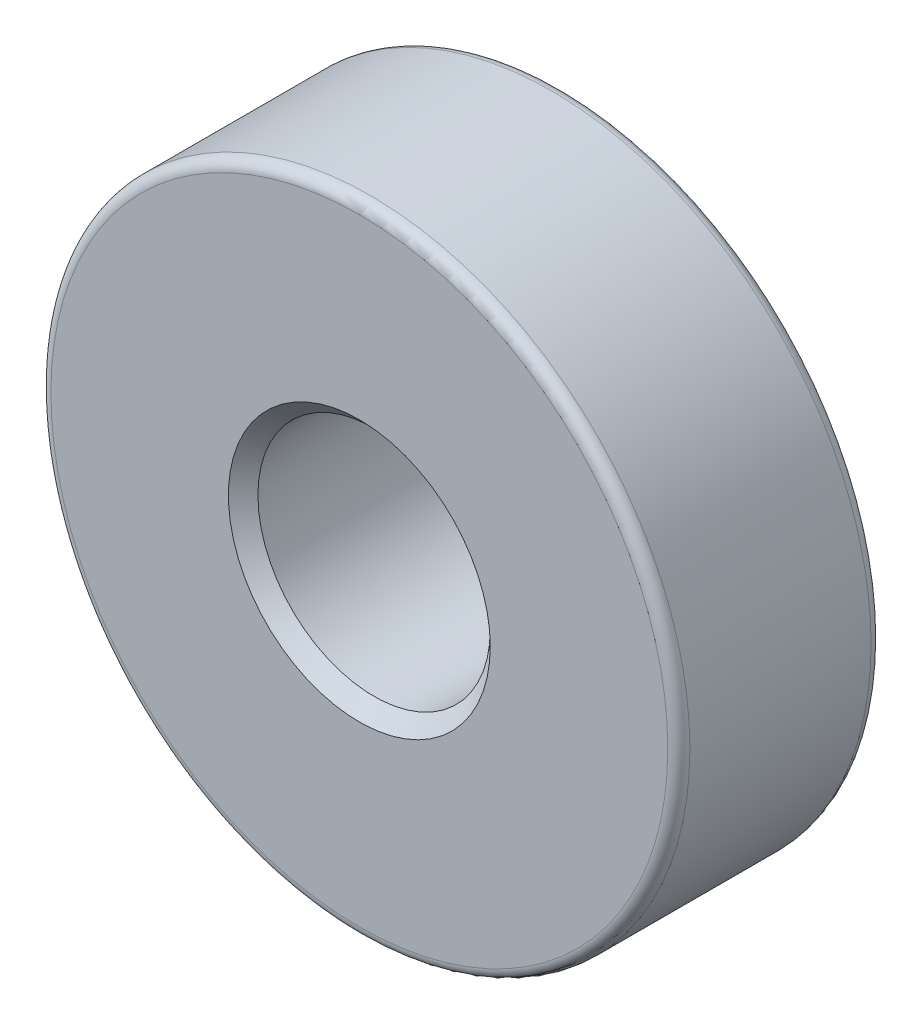
from build123d import *

# Parameters (mm, degrees)
SKETCH1_R           = 11
SKETCH1_R_2         = 4
BOSS_EXTRUDE1_DEPTH = 7
FILLET1_R           = 0.381
CHAMFER1_SIZE       = 0.508


with BuildPart() as part:
    # Sketch1 → Boss-Extrude1 (new body)
    with BuildSketch(Plane.XY):
        Circle(SKETCH1_R)
        Circle(SKETCH1_R_2, mode=Mode.SUBTRACT)
    extrude(amount=BOSS_EXTRUDE1_DEPTH)

    # Fillet1
    fillet1_edges = [part.edges().sort_by_distance(p)[0] for p in [
        (-11, 0, 0),
        (-11, 0, 7),
    ]]
    fillet(fillet1_edges, radius=FILLET1_R)

    # Chamfer1
    chamfer1_edges = [part.edges().sort_by_distance(p)[0] for p in [
        (-4, 0, 0),
        (-4, 0, 7),
    ]]
    chamfer(chamfer1_edges, length=CHAMFER1_SIZE)


solid = part.part
